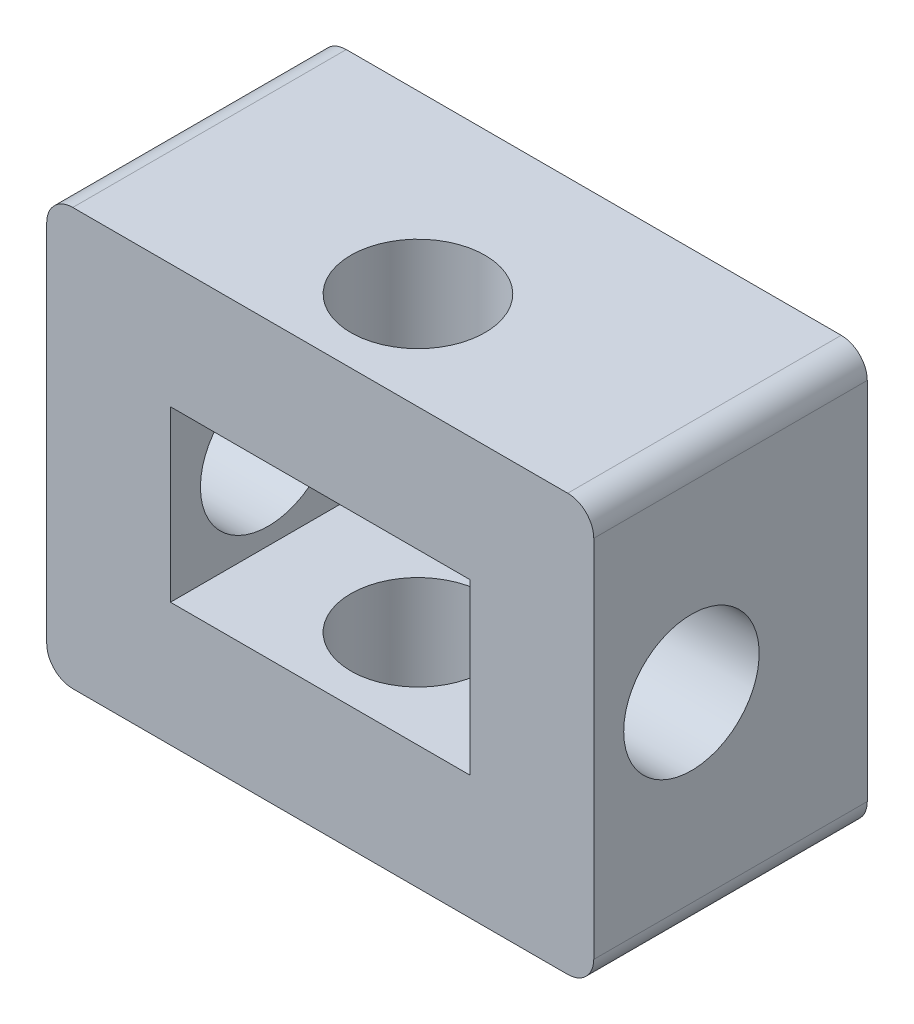
from build123d import *

# Parameters (mm, degrees)
SKETCH1_W               = 42
SKETCH1_H               = 32
BOSS_EXTRUDE1_DEPTH     = 21
SKETCH2_W               = 23
SKETCH2_H               = 13
CUT_EXTRUDE1_DEPTH      = 15
SKETCH3_R               = 4.5
CUT_EXTRUDE2_DEPTH      = 31.364452901
CUT_EXTRUDE3_DEPTH      = 42.871828238
CUT_EXTRUDE3_DEPTH_BACK = 42.871828238
SKETCH4_R               = 5.2
CUT_EXTRUDE4_DEPTH      = 38.259227045
CUT_EXTRUDE4_DEPTH_BACK = 38.259227045
SKETCH5_R               = 5.15
FILLET1_R               = 2


with BuildPart() as part:
    # Sketch1 → Boss-Extrude1 (new body)
    with BuildSketch(Plane.XY):
        Rectangle(SKETCH1_W, SKETCH1_H)
    extrude(amount=BOSS_EXTRUDE1_DEPTH)

    # Sketch2 → Cut-Extrude1 (cut)
    with BuildSketch(Plane.XY.offset(21)):
        Rectangle(SKETCH2_W, SKETCH2_H)
    extrude(amount=-CUT_EXTRUDE1_DEPTH, mode=Mode.SUBTRACT)

    # Sketch3 → Cut-Extrude2 (cut, through all)
    with BuildSketch(Plane.XY.offset(6)):
        with Locations((5.510924595, 0.660459353)):
            Circle(SKETCH3_R)
    extrude(amount=-CUT_EXTRUDE2_DEPTH, mode=Mode.SUBTRACT)

    # Sketch4 → Cut-Extrude3 (cut, two sides: drawn at the far end of the back side and taken through both)
    with BuildSketch(Plane.ZY.offset(-11.5).offset(-CUT_EXTRUDE3_DEPTH_BACK)):
        with Locations((13.5, 0)):
            Circle(SKETCH4_R)
    extrude(amount=CUT_EXTRUDE3_DEPTH + CUT_EXTRUDE3_DEPTH_BACK, mode=Mode.SUBTRACT)

    # Sketch5 → Cut-Extrude4 (cut, two sides: drawn at the far end of the back side and taken through both)
    with BuildSketch(Plane(origin=(0, -6.5, 0), x_dir=(1, 0, 0), z_dir=(0, 1, 0)).offset(-CUT_EXTRUDE4_DEPTH_BACK)):
        with Locations(Location((0, -13.5, 0), (0, 0, 180))):
            Circle(SKETCH5_R)
    extrude(amount=CUT_EXTRUDE4_DEPTH + CUT_EXTRUDE4_DEPTH_BACK, mode=Mode.SUBTRACT)

    # Fillet1
    fillet1_edges = [part.edges().sort_by_distance(p)[0] for p in [
        (-21, 16, 10.5),
        (21, 16, 10.5),
        (21, -16, 10.5),
        (-21, -16, 10.5),
    ]]
    fillet(fillet1_edges, radius=FILLET1_R)


solid = part.part
